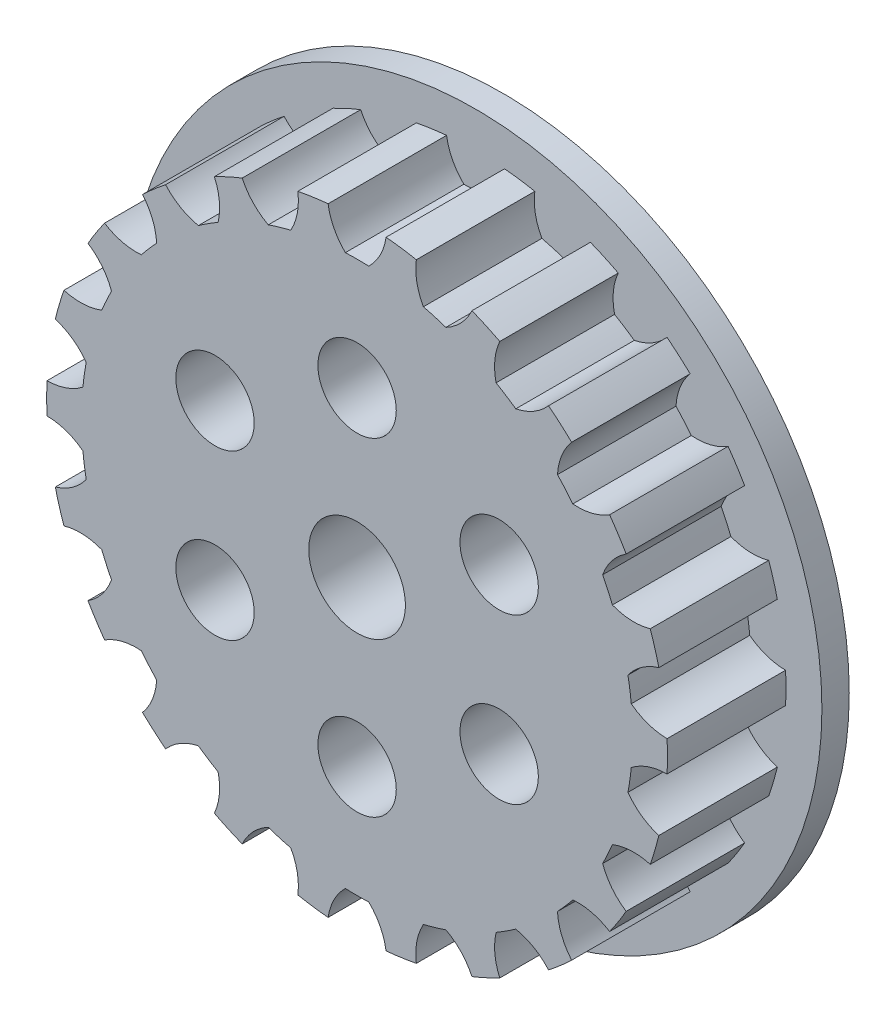
from build123d import *

# Parameters (mm, degrees)
SKETCH_1_R               = 17.02704374
EXTRUDE_1_DEPTH          = 6
SKETCH_1_6_R             = 17.02704374
EXTRUDE_2_DEPTH          = 8
SKETCH_1_7_R             = 19
EXTRUDE_3_DEPTH          = 1.5
CUT_EXTRUDE_START        = 1.5
CUT_EXTRUDE_3_DEPTH      = 27.535691538
PATTERN_CIRCULAR_1_COUNT = 22
HOLE_WIZARD_M4_1_D       = 4.3
PATTERN_CIRCULAR_2_COUNT = 6
HOLE_WIZARD_M5_1_D       = 5.3


with BuildPart() as part:
    # ｽｹｯﾁ1 → ﾎﾞｽ - 押し出し1 (new body)
    with BuildSketch(Plane.XY):
        Circle(SKETCH_1_R)
    extrude(amount=EXTRUDE_1_DEPTH)

    # ｽｹｯﾁ1<6> → ﾎﾞｽ - 押し出し2 (add)
    with BuildSketch(Plane.XY):
        Circle(SKETCH_1_6_R)
    extrude(amount=EXTRUDE_2_DEPTH)

    # ｽｹｯﾁ1<7> → ﾎﾞｽ - 押し出し3 (add)
    with BuildSketch(Plane.XY):
        Circle(SKETCH_1_7_R)
    extrude(amount=EXTRUDE_3_DEPTH)

    # ｽｹｯﾁ3 → ｶｯﾄ - 押し出し3 (cut, through all)
    with BuildSketch(Plane.XY.offset(CUT_EXTRUDE_START)):
        with BuildLine():
            ThreePointArc((0.642707961, 15.103375051), (1.267879301, 15.950333421), (1.58954065, 16.952686485))
            ThreePointArc((1.58954065, 16.952686485), (0, 17.02704374), (-1.58954065, 16.952686485))
            ThreePointArc((-1.58954065, 16.952686485), (-1.267879301, 15.950333421), (-0.642707961, 15.103375051))
            ThreePointArc((-0.642707961, 15.103375051), (0, 15.11704374), (0.642707961, 15.103375051))
        make_face()
    cut_extrude_3 = extrude(amount=CUT_EXTRUDE_3_DEPTH, mode=Mode.SUBTRACT)

    # 円形ﾊﾟﾀｰﾝ1: ｶｯﾄ - 押し出し3 ×22 about axis
    pattern_circular_1_axis = Axis((0, 0, 6), (0, 0, -1))
    for i in range(1, PATTERN_CIRCULAR_1_COUNT):
        add(cut_extrude_3.rotate(pattern_circular_1_axis, i * 360 / PATTERN_CIRCULAR_1_COUNT), mode=Mode.SUBTRACT)

    # M4 すきま穴1 (through all)
    with Locations(Plane(origin=(0, 9, 8), x_dir=(1, 0, 0), z_dir=(0, 0, 1))):
        with Locations((0, 0)):
            hole_wizard_m4_1 = Hole(HOLE_WIZARD_M4_1_D / 2)

    # 円形ﾊﾟﾀｰﾝ2: M4 すきま穴1 ×6 about axis
    pattern_circular_2_axis = Axis((0, 0, 1.5), (0, 0, -1))
    for i in range(1, PATTERN_CIRCULAR_2_COUNT):
        add(hole_wizard_m4_1.rotate(pattern_circular_2_axis, i * 360 / PATTERN_CIRCULAR_2_COUNT), mode=Mode.SUBTRACT)

    # M5 すきま穴1 (through all)
    with Locations(Plane(origin=(0, 0, 0), x_dir=(-1, 0, 0), z_dir=(0, 0, -1))):
        with Locations((0, 0)):
            Hole(HOLE_WIZARD_M5_1_D / 2)


solid = part.part
